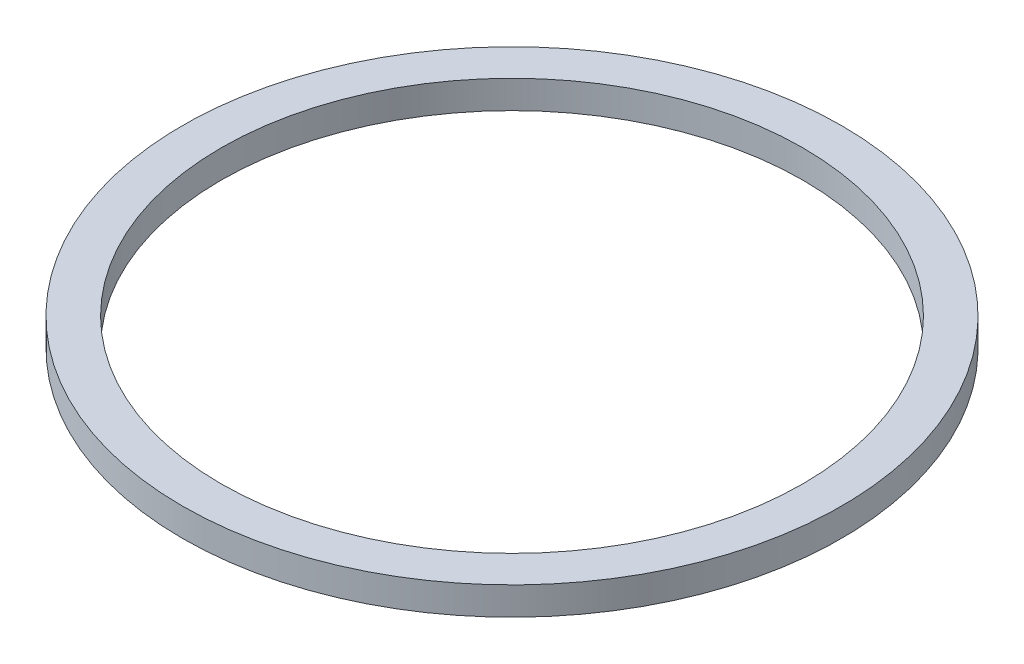
from build123d import *

# Parameters (mm, degrees)
SKETCH1_R           = 11.95
SKETCH1_R_2         = 10.55
BOSS_EXTRUDE1_DEPTH = 1.016


with BuildPart() as part:
    # Sketch1 → Boss-Extrude1 (new body)
    with BuildSketch(Plane(origin=(0, 0, 0), x_dir=(1, 0, 0), z_dir=(0, 1, 0))):
        with Locations(Location((0, 0, 0), (0, 0, 270))):
            Circle(SKETCH1_R)
        with Locations(Location((0, 0, 0), (0, 0, 270))):
            Circle(SKETCH1_R_2, mode=Mode.SUBTRACT)
    extrude(amount=BOSS_EXTRUDE1_DEPTH)


solid = part.part
